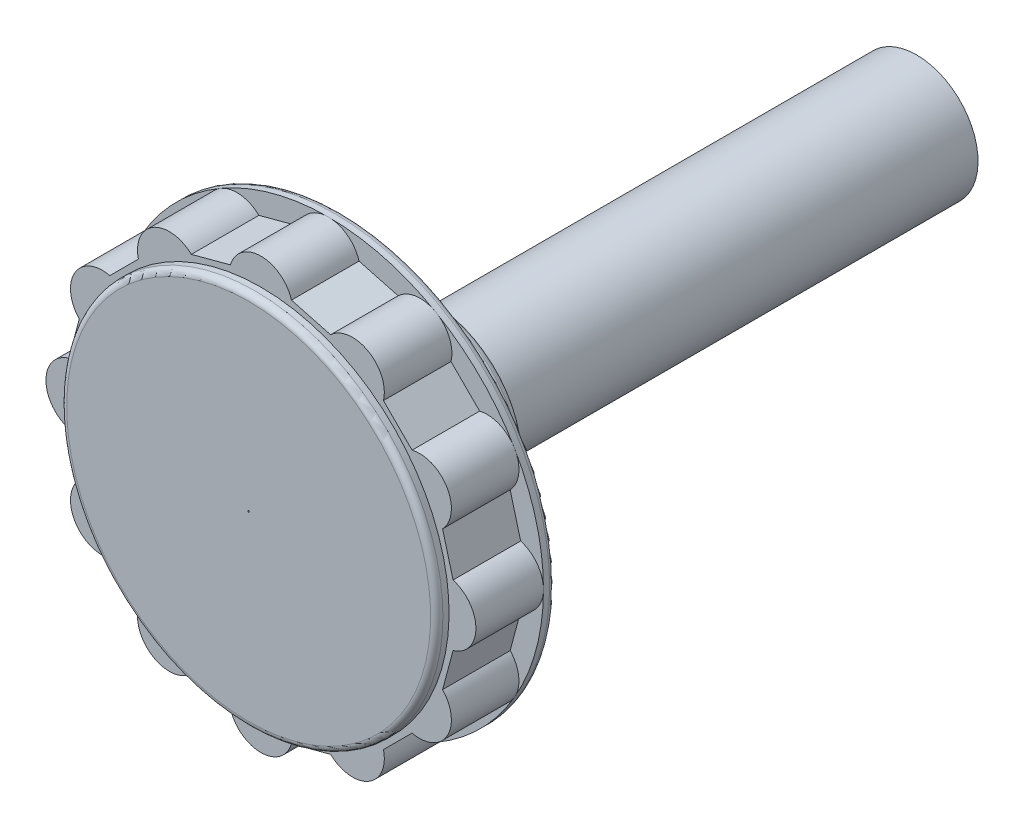
from build123d import *

# Parameters (mm, degrees)
CUT_EXTRUDE1_START          = -6.985
CUT_EXTRUDE1_DEPTH          = 6.985
CIRPATTERN1_COUNT           = 12
SKETCH6_W                   = 1.27
SKETCH6_H                   = 22.225
SKETCH7_W                   = 1.27
SKETCH7_H                   = 19.446875
FILLET1_R                   = 0.635
F_1_2_13_TAPPED_HOLE1_D     = 10.71626
F_1_2_13_TAPPED_HOLE1_DEPTH = 15.875
F_1_2_13_TAPPED_HOLE1_TIP   = 3.219489309
BOSS_EXTRUDE1_DEPTH         = 50
BOSS_EXTRUDE1_DEPTH_BACK    = 18
SKETCH11_R                  = 6.35


with BuildPart() as part:
    # Sketch4 → Revolve2 (revolve)
    with BuildSketch(Plane(origin=(0, 0, 0), x_dir=(0, 0, -1), z_dir=(1, 0, 0))):
        Polygon((0, 0), (0, 9.525), (-9.525, 9.525), (-9.525, 22.225), (-16.1925, 22.225), (-19.05, 22.225), (-19.05, 0), align=None)
    revolve(axis=Axis((0, 0, 0), (0, 0, 1)))

    # Sketch5 → Cut-Extrude1 (cut)
    with BuildSketch(Plane(origin=(0, 0, 10.795), x_dir=(-1, 0, 0), z_dir=(0, 0, -1)).offset(CUT_EXTRUDE1_START)):
        with BuildLine():
            Line((-3.156573404, 19.862310504), (-7.197482495, 18.779552177))
            ThreePointArc((-7.197482495, 18.779552177), (-9.077139161, 19.664940458), (-11.1125, 19.247414599))
            Line((-11.1125, 19.247414599), (-21.036811986, 36.436827189))
            Line((-21.036811986, 36.436827189), (0, 42.073623972))
            Line((0, 42.073623972), (0, 22.225))
            ThreePointArc((0, 22.225), (-1.971437122, 21.568907581), (-3.156573404, 19.862310504))
        make_face()
    cut_extrude1 = extrude(amount=CUT_EXTRUDE1_DEPTH, mode=Mode.SUBTRACT)

    # CirPattern1: Cut-Extrude1 ×12 about axis
    cirpattern1_axis = Axis((0, 0, 0), (0, 0, 1))
    for i in range(1, CIRPATTERN1_COUNT):
        add(cut_extrude1.rotate(cirpattern1_axis, i * 360 / CIRPATTERN1_COUNT), mode=Mode.SUBTRACT)

    # Sketch6 → Cut-Revolve3 (revolve, cut)
    with BuildSketch(Plane(origin=(0, 0, 0), x_dir=(0, 0, -1), z_dir=(1, 0, 0))):
        with Locations((-18.415, 11.1125)):
            Rectangle(SKETCH6_W, SKETCH6_H)
    revolve(axis=Axis((0, 0, 0), (0, 0, 1)), mode=Mode.SUBTRACT)

    # Sketch7 → Revolve3 (revolve)
    with BuildSketch(Plane(origin=(0, 0, 0), x_dir=(0, 0, -1), z_dir=(1, 0, 0))):
        with Locations((-18.415, 9.7234375)):
            Rectangle(SKETCH7_W, SKETCH7_H)
    revolve(axis=Axis((0, 0, 0), (0, 0, 1)))

    # Fillet1
    fillet1_edges = [part.edges().sort_by_distance(p)[0] for p in [
        (0, -19.446875, 19.05),
        (0, -22.225, 9.525),
        (0, -9.525, 0),
    ]]
    fillet(fillet1_edges, radius=FILLET1_R)

    # 1/2-13 Tapped Hole1
    with Locations(Plane(origin=(0, 0, 0), x_dir=(-1, 0, 0), z_dir=(0, 0, -1))):
        with Locations((0, 0)):
            Hole(F_1_2_13_TAPPED_HOLE1_D / 2, depth=F_1_2_13_TAPPED_HOLE1_DEPTH)
            with Locations((0, 0, -(F_1_2_13_TAPPED_HOLE1_DEPTH + F_1_2_13_TAPPED_HOLE1_TIP / 2))):  # 118° drill point
                Cone(0, F_1_2_13_TAPPED_HOLE1_D / 2, F_1_2_13_TAPPED_HOLE1_TIP, mode=Mode.SUBTRACT)


with BuildPart() as body_2:
    # Sketch11 → Boss-Extrude1 (new, two sides: drawn at the far end of the back side and taken through both)
    with BuildSketch(Plane(origin=(0, 0, 0), x_dir=(-1, 0, 0), z_dir=(0, 0, -1)).offset(-BOSS_EXTRUDE1_DEPTH_BACK)):
        with Locations(Location((0, 0, 0), (0, 0, 90))):
            Circle(SKETCH11_R)
    extrude(amount=BOSS_EXTRUDE1_DEPTH + BOSS_EXTRUDE1_DEPTH_BACK)


solid = Compound([part.part, body_2.part])
